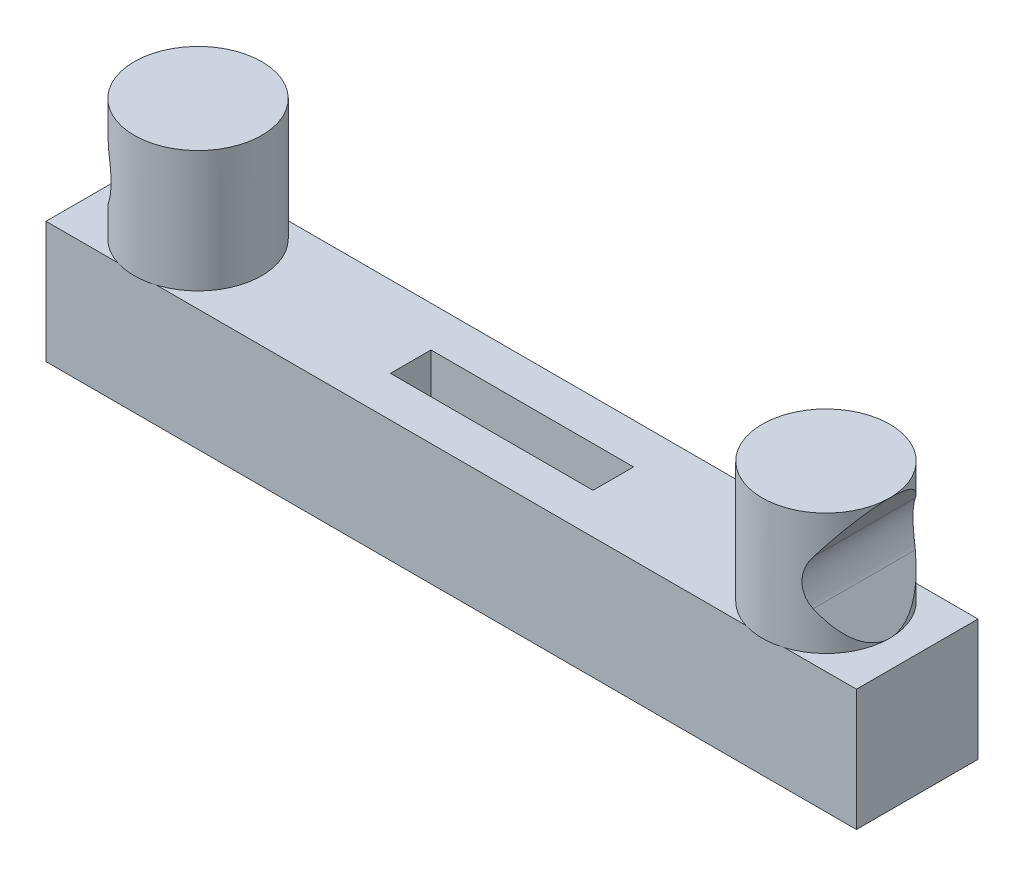
from build123d import *
from build123d.topology import SkipClean

# Parameters (mm, degrees)
SKETCH1_W            = 50.8
SKETCH1_H            = 7.62
BOSS_EXTRUDE1_DEPTH  = 7.62
SKETCH2_W            = 12.7
SKETCH2_H            = 2.54
CUT_EXTRUDE1_DEPTH   = 27.790679349
SKETCH3_R            = 4
BOSS_EXTRUDE2_DEPTH  = 7.62
CUT_EXTRUDE2_DEPTH   = 7.62
FILLET1_R            = 2.54
FILLET1_OF_MIRROR1_R = 2.54


with BuildPart() as part:
    # Sketch1 → Boss-Extrude1 (new body)
    with BuildSketch(Plane(origin=(0, 0, 0), x_dir=(1, 0, 0), z_dir=(0, 1, 0))):
        Rectangle(SKETCH1_W, SKETCH1_H)
    extrude(amount=BOSS_EXTRUDE1_DEPTH)

    # Sketch2 → Cut-Extrude1 (cut, through all)
    with BuildSketch(Plane(origin=(0, 7.62, 0), x_dir=(1, 0, 0), z_dir=(0, 1, 0))):
        Rectangle(SKETCH2_W, SKETCH2_H)
    extrude(amount=-CUT_EXTRUDE1_DEPTH, mode=Mode.SUBTRACT)

    # Sketch3 → Boss-Extrude2 (add)
    with BuildSketch(Plane(origin=(0, 7.62, 0), x_dir=(1, 0, 0), z_dir=(0, 1, 0))):
        with Locations(Location((-19.681240592, 0, 0), (0, 0, 72.269593739))):
            Circle(SKETCH3_R)
    boss_extrude2 = extrude(amount=BOSS_EXTRUDE2_DEPTH)

    # Sketch4 → Cut-Extrude2 (cut, symmetric)
    with SkipClean():  # the faces are left unmerged after this step: merging them gives an invalid solid
        with BuildSketch(Plane.XY):
            Polygon((-23.681240592, 15.24), (-23.681240592, 7.62), (-21.141240592, 11.43), align=None)
        cut_extrude2 = extrude(amount=CUT_EXTRUDE2_DEPTH, both=True, mode=Mode.SUBTRACT)

    # Fillet1
    fillet1_edges = [part.edges().sort_by_distance(p)[0] for p in [
        (-21.141240592, 11.43, 0),
    ]]
    fillet(fillet1_edges, radius=FILLET1_R)

    # Mirror1: Boss-Extrude2, Cut-Extrude2 across plane
    add(boss_extrude2.mirror(Plane(origin=(0, 0, 0), x_dir=(0, 0, 1), z_dir=(1, 0, 0))))
    add(cut_extrude2.mirror(Plane(origin=(0, 0, 0), x_dir=(0, 0, 1), z_dir=(1, 0, 0))), mode=Mode.SUBTRACT)

    # Fillet1 of Mirror1
    fillet1_of_mirror1_edges = [part.edges().sort_by_distance(p)[0] for p in [
        (21.141240592, 11.43, 0),
    ]]
    fillet(fillet1_of_mirror1_edges, radius=FILLET1_OF_MIRROR1_R)


solid = part.part
